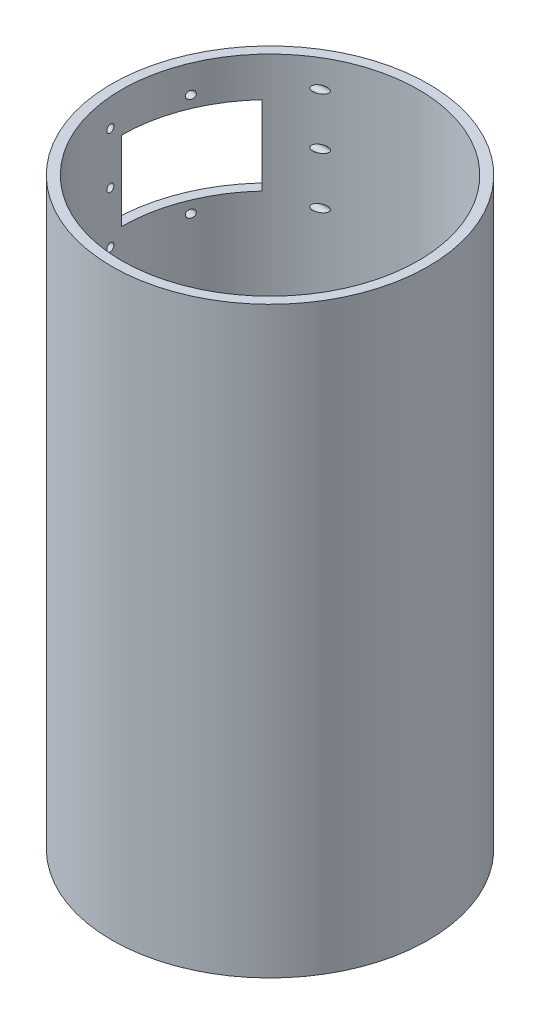
from build123d import *

# Parameters (mm, degrees)
SKETCH2_R           = 101.6
SKETCH2_R_2         = 95.25
BOSS_EXTRUDE1_DEPTH = 374.65
SKETCH3_W           = 31.75
SKETCH3_H           = 50.8
CUT_EXTRUDE2_DEPTH  = 402.257700861
SKETCH4_R           = 2.5
CUT_EXTRUDE3_DEPTH  = 402.257700861


with BuildPart() as part:
    # Sketch2 → Boss-Extrude1 (new body)
    with BuildSketch(Plane(origin=(0, 0, 0), x_dir=(1, 0, 0), z_dir=(0, 1, 0))):
        with Locations(Location((0, 0, 0), (0, 0, 90))):
            Circle(SKETCH2_R)
        with Locations(Location((0, 0, 0), (0, 0, 90))):
            Circle(SKETCH2_R_2, mode=Mode.SUBTRACT)
    extrude(amount=BOSS_EXTRUDE1_DEPTH)

    # Sketch3 → Cut-Extrude2 (cut, through all)
    with BuildSketch(Plane.XY):
        with Locations((-85.725, 323.886005252)):
            Rectangle(SKETCH3_W, SKETCH3_H)
    extrude(amount=-CUT_EXTRUDE2_DEPTH, mode=Mode.SUBTRACT)

    # Sketch4 → Cut-Extrude3 (cut, through all)
    with BuildSketch(Plane(origin=(0, 0, 0), x_dir=(0, 0, -1), z_dir=(1, 0, 0))):
        with Locations((81.400332745, 356.906005252)):
            Circle(SKETCH4_R)
        with Locations((36.890166373, 356.906005252)):
            Circle(SKETCH4_R)
        with Locations((-7.62, 356.906005252)):
            Circle(SKETCH4_R)
        with Locations((-7.62, 323.886005252)):
            Circle(SKETCH4_R)
        with Locations((-7.62, 290.866005252)):
            Circle(SKETCH4_R)
        with Locations((36.890166373, 290.866005252)):
            Circle(SKETCH4_R)
        with Locations((81.400332745, 290.866005252)):
            Circle(SKETCH4_R)
        with Locations((81.400332745, 323.886005252)):
            Circle(SKETCH4_R)
    extrude(amount=-CUT_EXTRUDE3_DEPTH, mode=Mode.SUBTRACT)


solid = part.part
